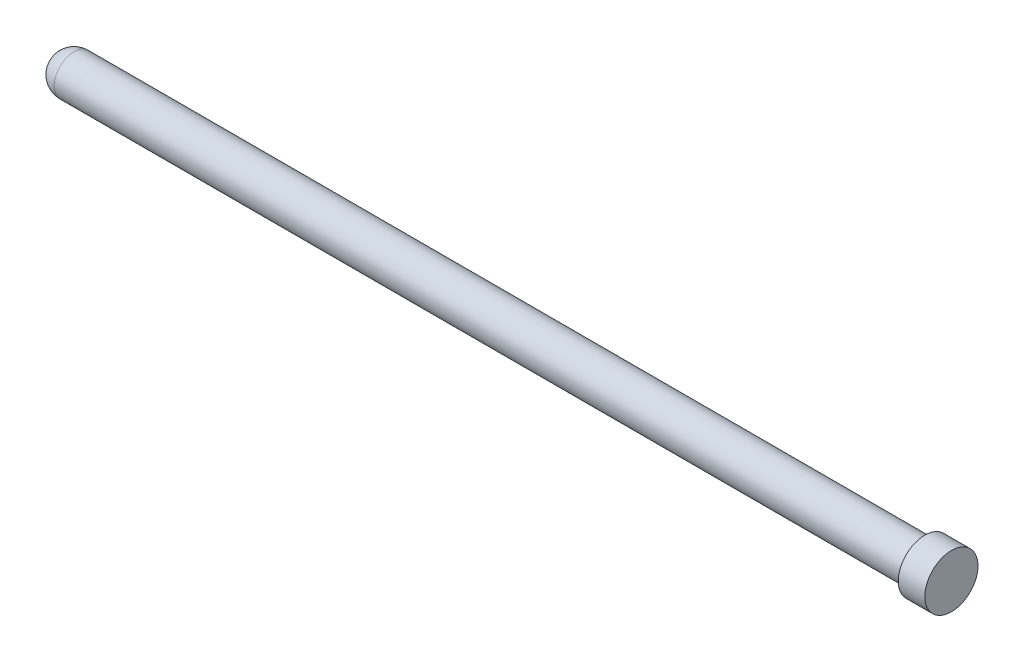
from build123d import *

# Parameters (mm, degrees)
SKETCH1_R           = 9.525
BOSS_EXTRUDE1_DEPTH = 406.4
SKETCH3_R           = 12.7
BOSS_EXTRUDE2_DEPTH = 12.7


with BuildPart() as part:
    # Sketch1 → Boss-Extrude1 (new body)
    with BuildSketch(Plane(origin=(0, 0, 0), x_dir=(0, 0, -1), z_dir=(1, 0, 0))):
        Circle(SKETCH1_R)
    extrude(amount=BOSS_EXTRUDE1_DEPTH)

    # Sketch2 → Revolve1 (revolve)
    with BuildSketch(Plane.XY, mode=Mode.PRIVATE) as revolve1_sk:
        with BuildLine():
            Line((-9.525, 0), (0, 0))
            Line((0, 0), (0, 9.525))
            ThreePointArc((0, 9.525), (-6.735192091, 6.735192091), (-9.525, 0))
        make_face()
    revolve(revolve1_sk.sketch.rotate(Axis((-9.525, 0, 0), (1, 0, 0)), 90), axis=Axis((-9.525, 0, 0), (1, 0, 0)))

    # Sketch3 → Boss-Extrude2 (add)
    with BuildSketch(Plane(origin=(406.4, 0, 0), x_dir=(0, 0, -1), z_dir=(1, 0, 0))):
        Circle(SKETCH3_R)
    extrude(amount=BOSS_EXTRUDE2_DEPTH)


solid = part.part
